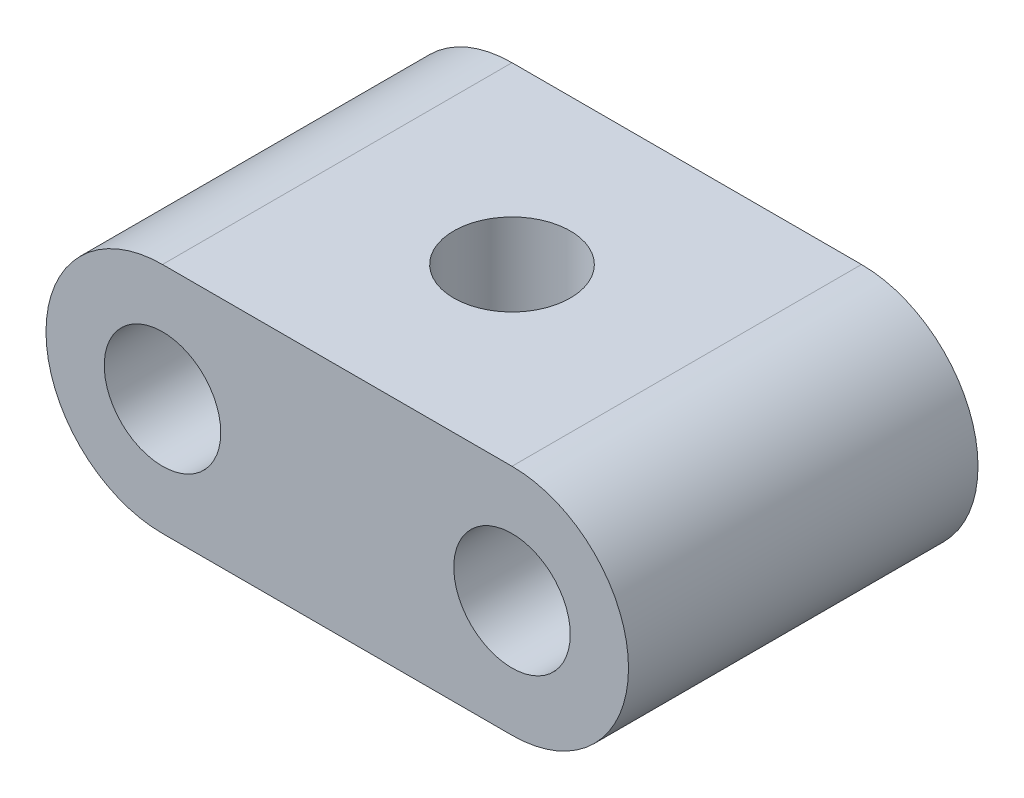
from build123d import *

# Parameters (mm, degrees)
IZIM2_R                     = 5
Y_KSEKLIK_EKSTR_ZYON1_DEPTH = 30
IZIM3_R                     = 5
KES_EKSTR_ZYON1_DEPTH       = 20


with BuildPart() as part:
    # Çizim2 → Yükseklik-Ekstrüzyon1 (new body)
    with BuildSketch(Plane.XY):
        with BuildLine():
            Line((-37.499405752, 34.008081768), (-7.499405752, 34.008081768))
            ThreePointArc((-7.499405752, 34.008081768), (2.500594248, 24.008081768), (-7.499405752, 14.008081768))
            Line((-7.499405752, 14.008081768), (-37.499405752, 14.008081768))
            ThreePointArc((-37.499405752, 14.008081768), (-47.499405752, 24.008081768), (-37.499405752, 34.008081768))
        make_face()
        with Locations((-37.499405752, 24.008081768)):
            Circle(IZIM2_R, mode=Mode.SUBTRACT)
        with Locations((-7.499405752, 24.008081768)):
            Circle(IZIM2_R, mode=Mode.SUBTRACT)
    extrude(amount=Y_KSEKLIK_EKSTR_ZYON1_DEPTH)

    # Çizim3 → Kes-Ekstrüzyon1 (cut)
    with BuildSketch(Plane(origin=(0, 34.008081768, 0), x_dir=(1, 0, 0), z_dir=(0, 1, 0))):
        with Locations(Location((-22.499405752, -15, 0), (0, 0, 270))):
            Circle(IZIM3_R)
    extrude(amount=-KES_EKSTR_ZYON1_DEPTH, mode=Mode.SUBTRACT)


solid = part.part
